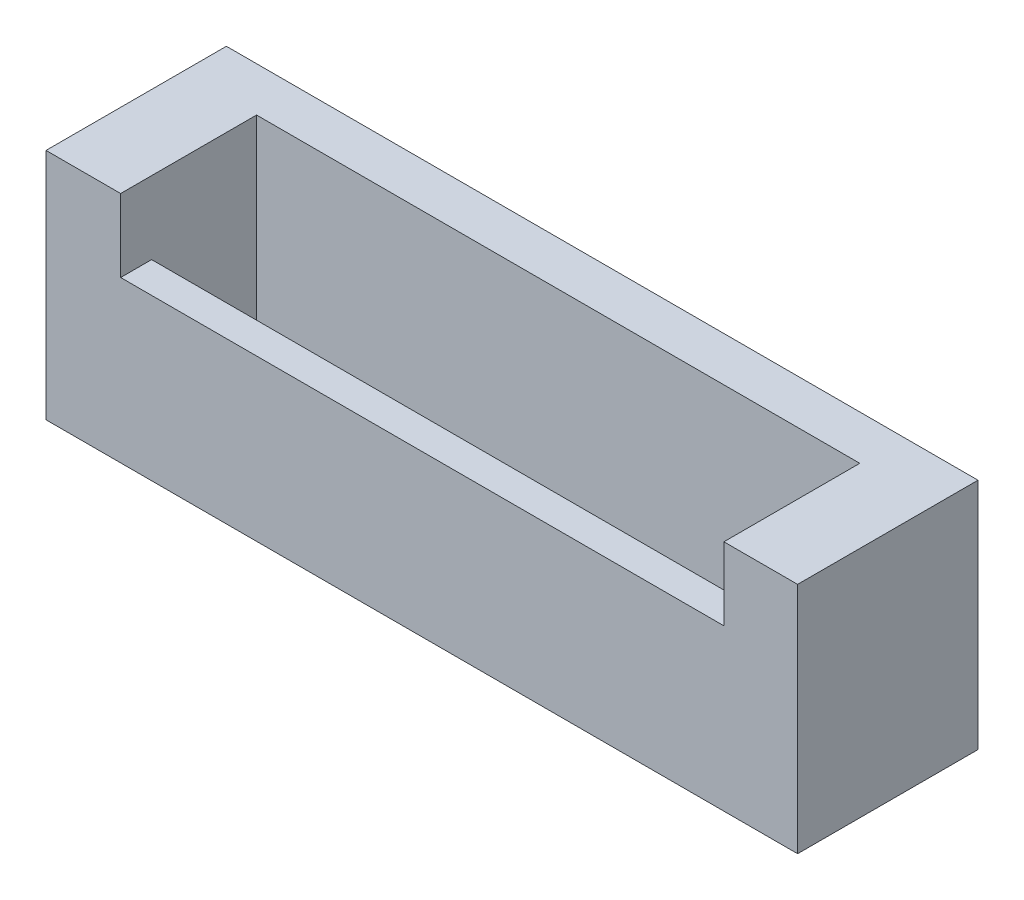
from build123d import *

# Parameters (mm, degrees)
SKETCH1_W           = 50
SKETCH1_H           = 12
BOSS_EXTRUDE1_DEPTH = 15.52
SKETCH2_W           = 40.13
SKETCH2_H           = 6.98
CUT_EXTRUDE1_DEPTH  = 15
SKETCH3_W           = 40.13
SKETCH3_H           = 2.061819863
CUT_EXTRUDE2_DEPTH  = 4.84


with BuildPart() as part:
    # Sketch1 → Boss-Extrude1 (new body)
    with BuildSketch(Plane(origin=(0, 0, 0), x_dir=(1, 0, 0), z_dir=(0, 1, 0))):
        with Locations((-25, -6)):
            Rectangle(SKETCH1_W, SKETCH1_H)
    extrude(amount=BOSS_EXTRUDE1_DEPTH)

    # Sketch2 → Cut-Extrude1 (cut)
    with BuildSketch(Plane(origin=(0, 15.52, 0), x_dir=(1, 0, 0), z_dir=(0, 1, 0))):
        with Locations((-24.96964194, -6.448180137)):
            Rectangle(SKETCH2_W, SKETCH2_H)
    extrude(amount=-CUT_EXTRUDE1_DEPTH, mode=Mode.SUBTRACT)

    # Sketch3 → Cut-Extrude2 (cut)
    with BuildSketch(Plane(origin=(0, 15.52, 0), x_dir=(1, 0, 0), z_dir=(0, 1, 0))):
        with Locations((-24.96964194, -10.969090068)):
            Rectangle(SKETCH3_W, SKETCH3_H)
    extrude(amount=-CUT_EXTRUDE2_DEPTH, mode=Mode.SUBTRACT)


solid = part.part
